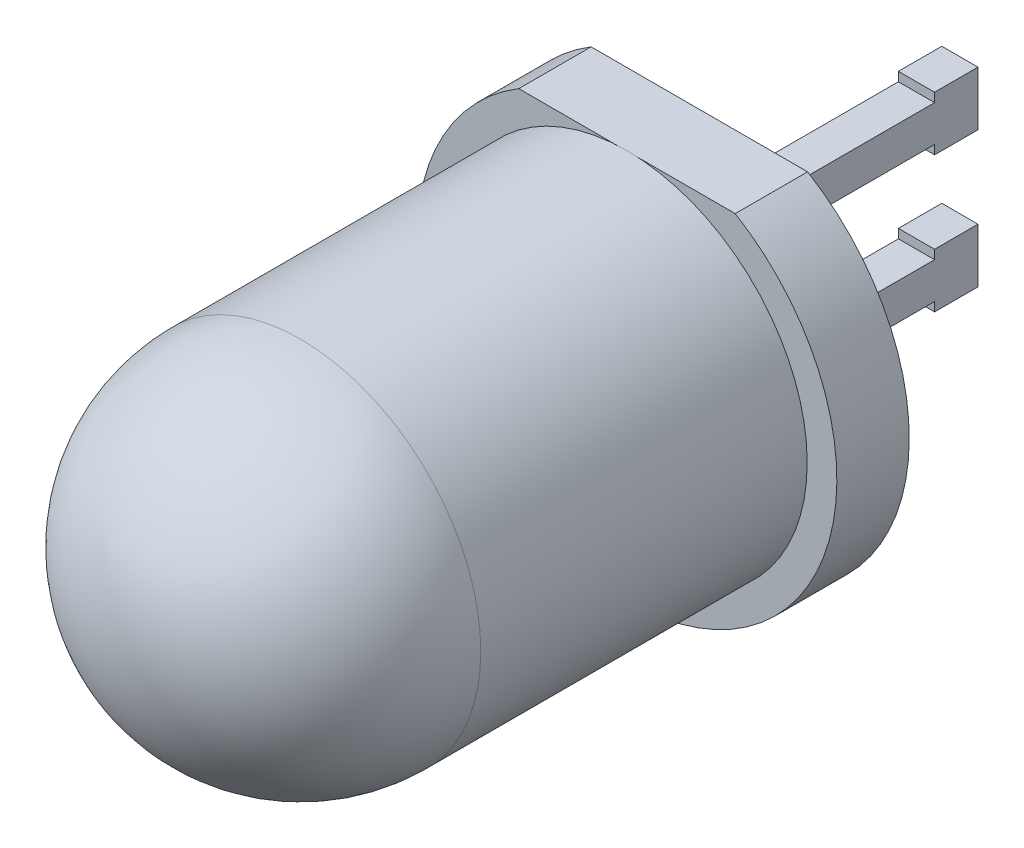
from build123d import *

# Parameters (mm, degrees)
SKETCH1_R           = 2.49
EXTRUDE1_DEPTH      = 7
FILLET2_R           = 2.49
SKETCH2_R           = 2.9
EXTRUDE2_DEPTH      = 1
SKETCH3_W           = 3.764524328
SKETCH3_H           = 0.567574437
CUT_EXTRUDE3_DEPTH  = 1
SKETCH5_W           = 0.5
SKETCH5_H           = 0.5
EXTRUS_O1_DEPTH     = 28
SKETCH5_3_W         = 0.5
SKETCH5_3_H         = 0.5
EXTRUS_O2_DEPTH     = 25.4
ESBO_O1_W           = 1.5
ESBO_O1_H           = 0.75
EXTRUS_O3_DEPTH     = 0.5
SKETCH_1_W          = 24.4
SKETCH_1_H          = 5.384586057
CUT_EXTRUDE_4_DEPTH = 10


with BuildPart() as part:
    # Sketch1 → Extrude1 (new body)
    with BuildSketch(Plane.XY):
        Circle(SKETCH1_R)
    extrude(amount=EXTRUDE1_DEPTH)

    # Fillet2
    fillet2_edges = [part.edges().sort_by_distance(p)[0] for p in [
        (-2.49, 0, 7),
    ]]
    fillet(fillet2_edges, radius=FILLET2_R)


with BuildPart() as body_2:
    # Sketch2 → Extrude2 (new body)
    with BuildSketch(Plane(origin=(0, 0, 0), x_dir=(-1, 0, 0), z_dir=(0, 0, -1))):
        Circle(SKETCH2_R)
    extrude(amount=EXTRUDE2_DEPTH)

    # Sketch3 → Cut-Extrude3 (cut)
    with BuildSketch(Plane(origin=(0, 0, -1), x_dir=(-1, 0, 0), z_dir=(0, 0, -1))):
        with Locations((-0.09845679, 2.768373276)):
            Rectangle(SKETCH3_W, SKETCH3_H)
    extrude(amount=-CUT_EXTRUDE3_DEPTH, mode=Mode.SUBTRACT)

    # Sketch5 → Extrusão1 (add)
    with BuildSketch(Plane(origin=(0, 0, -1), x_dir=(-1, 0, 0), z_dir=(0, 0, -1))):
        with Locations((0, -0.9397033)):
            Rectangle(SKETCH5_W, SKETCH5_H)
    extrude(amount=EXTRUS_O1_DEPTH)

    # Sketch5<3> → Extrusão2 (add)
    with BuildSketch(Plane(origin=(0, 0, -1), x_dir=(-1, 0, 0), z_dir=(0, 0, -1))):
        with Locations((0, 0.9397033)):
            Rectangle(SKETCH5_3_W, SKETCH5_3_H)
    extrude(amount=EXTRUS_O2_DEPTH)

    # Esboço1 → Extrusão3 (add)
    with BuildSketch(Plane.ZY.offset(0.25)):
        with Locations((-4.75, 0.9397033)):
            Rectangle(ESBO_O1_W, ESBO_O1_H)
        with Locations((-4.75, -0.9397033)):
            Rectangle(ESBO_O1_W, ESBO_O1_H)
    extrude(amount=-EXTRUS_O3_DEPTH)

    # ｽｹｯﾁ1 → ｶｯﾄ - 押し出し4 (cut)
    with BuildSketch(Plane(origin=(0.25, 0, 0), x_dir=(0, 0, -1), z_dir=(1, 0, 0))):
        with Locations((16.8, -0.207706972)):
            Rectangle(SKETCH_1_W, SKETCH_1_H)
    extrude(amount=-CUT_EXTRUDE_4_DEPTH, mode=Mode.SUBTRACT)


solid = Compound([part.part, body_2.part])
